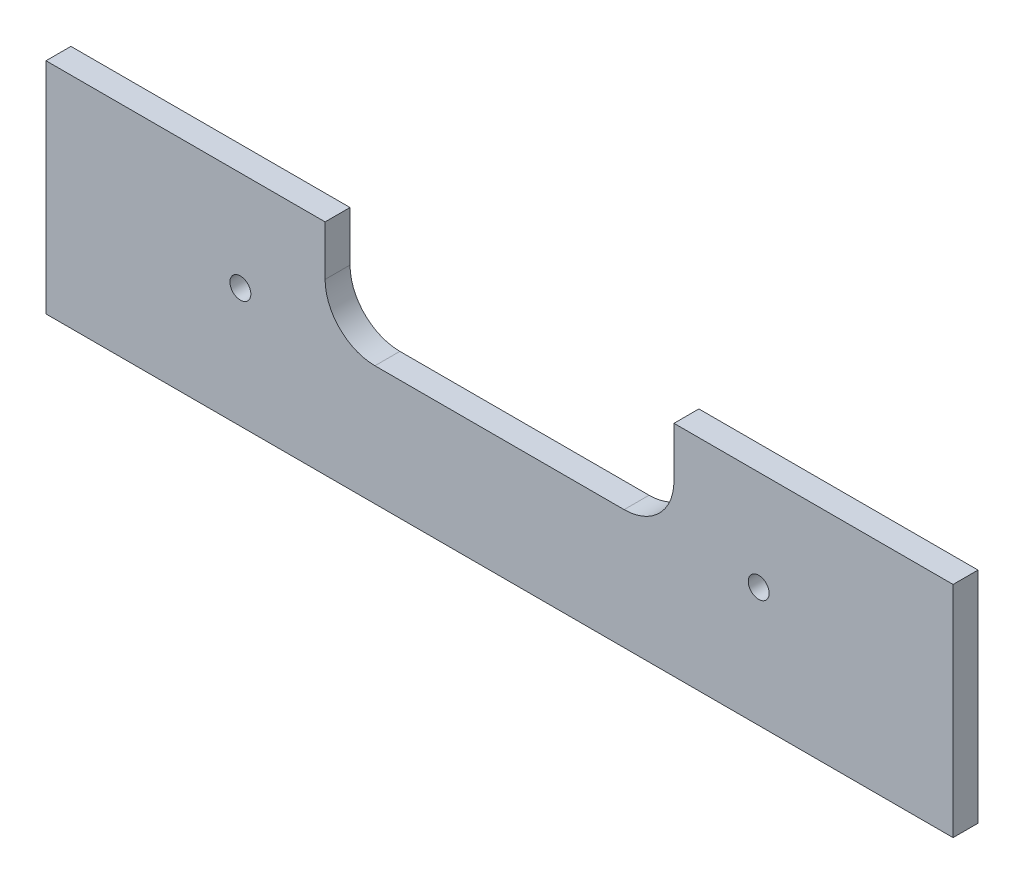
from build123d import *

# Parameters (mm, degrees)
SKIZZE1_W                       = 182
SKIZZE1_H                       = 50
AUFSATZ_LINEAR_AUSTRAGEN1_DEPTH = 5
M5_GEWINDEBOHRUNG1_D            = 4.2
M5_GEWINDEBOHRUNG1_DEPTH        = 14
M5_GEWINDEBOHRUNG1_TIP          = 1.2618073
SKIZZE4_W                       = 70
SKIZZE4_H                       = 20
SKIZZE4_W_2                     = 182
SKIZZE4_H_2                     = 6
SCHNITT_LINEAR_AUSTRAGEN1_DEPTH = 10
VERRUNDUNG2_R                   = 10


with BuildPart() as part:
    # Skizze1 → Aufsatz-Linear austragen1 (new body)
    with BuildSketch(Plane.XY):
        Rectangle(SKIZZE1_W, SKIZZE1_H)
    extrude(amount=AUFSATZ_LINEAR_AUSTRAGEN1_DEPTH)

    # M5 Gewindebohrung1
    with Locations(Plane.XY.offset(5)):
        with Locations((52, 5), (-52, 5)):
            Hole(M5_GEWINDEBOHRUNG1_D / 2, depth=M5_GEWINDEBOHRUNG1_DEPTH)
            with Locations((0, 0, -(M5_GEWINDEBOHRUNG1_DEPTH + M5_GEWINDEBOHRUNG1_TIP / 2))):  # 118° drill point
                Cone(0, M5_GEWINDEBOHRUNG1_D / 2, M5_GEWINDEBOHRUNG1_TIP, mode=Mode.SUBTRACT)

    # Skizze4 → Schnitt-Linear austragen1 (cut)
    with BuildSketch(Plane.XY.offset(5)):
        with Locations((0, 15)):
            Rectangle(SKIZZE4_W, SKIZZE4_H)
        with Locations((0, -22)):
            Rectangle(SKIZZE4_W_2, SKIZZE4_H_2)
    extrude(amount=-SCHNITT_LINEAR_AUSTRAGEN1_DEPTH, mode=Mode.SUBTRACT)

    # Verrundung2
    verrundung2_edges = [part.edges().sort_by_distance(p)[0] for p in [
        (-35, 5, 2.5),
        (35, 5, 2.5),
    ]]
    fillet(verrundung2_edges, radius=VERRUNDUNG2_R)


solid = part.part
